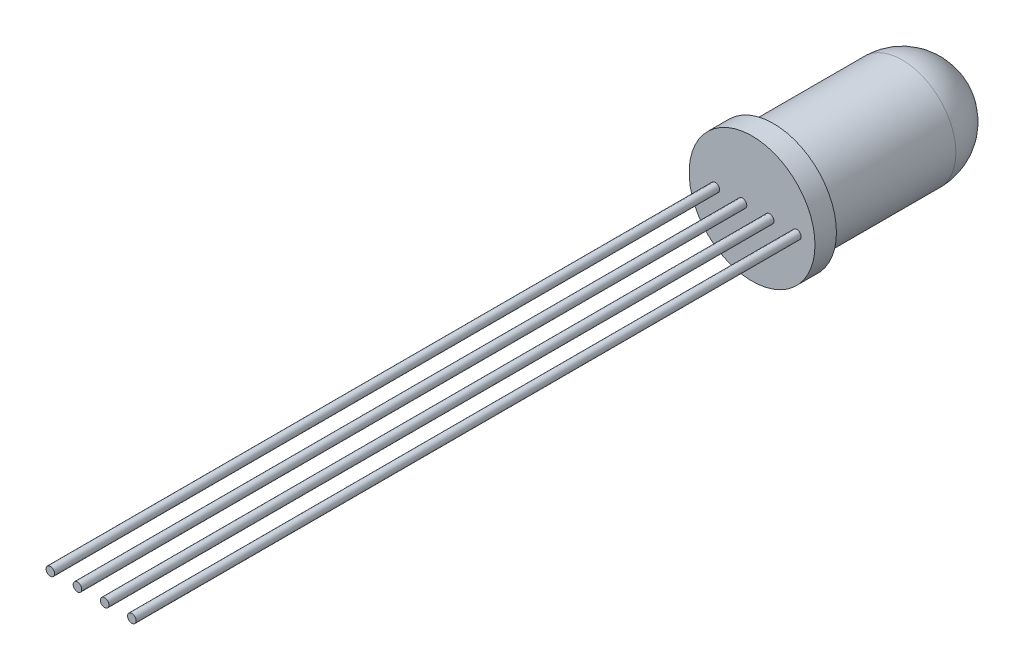
from build123d import *

# Parameters (mm, degrees)
SKETCH1_R           = 2.5
BOSS_EXTRUDE1_DEPTH = 8.5
SKETCH3_R           = 2.932976034
BOSS_EXTRUDE3_DEPTH = 1
FILLET1_R           = 2.5
SKETCH4_R           = 0.2
BOSS_EXTRUDE4_DEPTH = 31


with BuildPart() as part:
    # Sketch1 → Boss-Extrude1 (new body)
    with BuildSketch(Plane.XY):
        Circle(SKETCH1_R)
    extrude(amount=BOSS_EXTRUDE1_DEPTH)

    # Sketch3 → Boss-Extrude3 (add)
    with BuildSketch(Plane.XY.offset(8.5)):
        Circle(SKETCH3_R)
    extrude(amount=BOSS_EXTRUDE3_DEPTH)

    # Fillet1
    fillet1_edges = [part.edges().sort_by_distance(p)[0] for p in [
        (-2.5, 0, 0),
    ]]
    fillet(fillet1_edges, radius=FILLET1_R)

    # Sketch4 → Boss-Extrude4 (add)
    with BuildSketch(Plane.XY.offset(9.5)):
        with Locations((-1.71346028, 0)):
            Circle(SKETCH4_R)
        with Locations((-0.44686028, 0)):
            Circle(SKETCH4_R)
        with Locations((0.81979972, 0)):
            Circle(SKETCH4_R)
        with Locations((2.08645972, 0)):
            Circle(SKETCH4_R)
    extrude(amount=BOSS_EXTRUDE4_DEPTH)


solid = part.part
